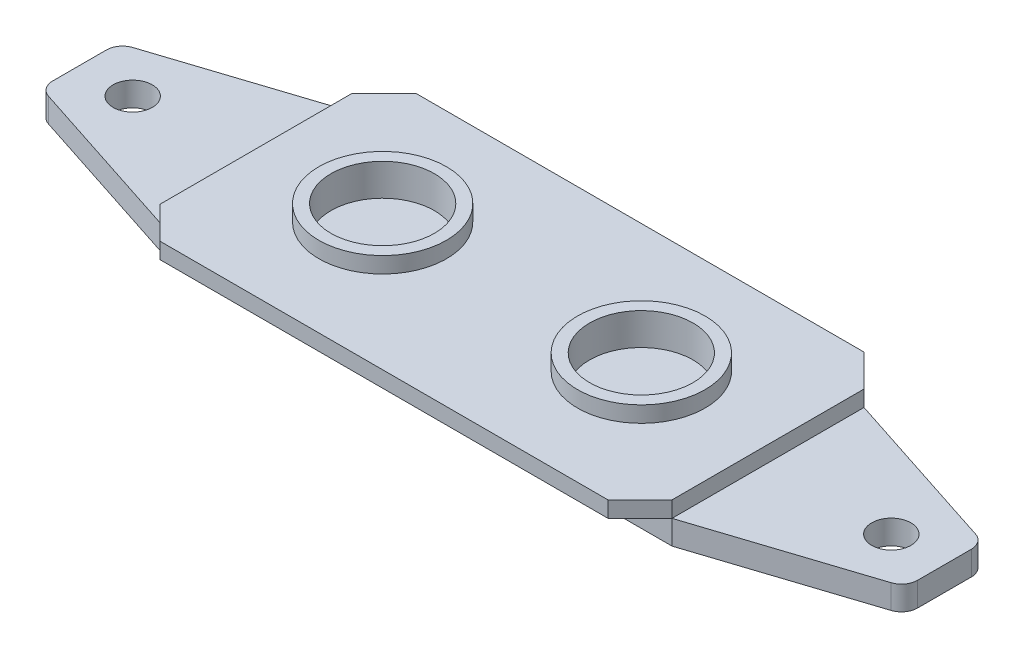
from build123d import *

# Parameters (mm, degrees)
EXTRUDE1_DEPTH = 3.175
SKETCH5_R      = 12.6587948
SKETCH5_R_2    = 10.263887676
EXTRUDE2_DEPTH = 3.175
SKETCH7_R      = 10.263887676
EXTRUDE3_DEPTH = 114.636616568
SKETCH8_R      = 3.888872997
SKETCH8_W      = 50.8
SKETCH8_H      = 38.1
EXTRUDE4_DEPTH = 4.7752


with BuildPart() as part:
    # Sketch4 → Extrude1 (new body)
    with BuildSketch(Plane(origin=(0, 0, 0), x_dir=(1, 0, 0), z_dir=(0, 1, 0))):
        Polygon((0, 44.45), (6.35, 50.8), (95.25, 50.8), (101.6, 44.45), (101.6, 6.35), (95.25, 0), (6.35, 0), (0, 6.35), align=None)
    extrude(amount=-EXTRUDE1_DEPTH)

    # Sketch5 → Extrude2 (add)
    # profile 1 of 2: a face of its own
    with BuildSketch(Plane(origin=(0, 0, 0), x_dir=(1, 0, 0), z_dir=(0, 1, 0))):
        with Locations(Location((25.140280811, 25.4, 0), (0, 0, 90))):
            Circle(SKETCH5_R)
        with Locations(Location((25.140280811, 25.4, 0), (0, 0, 270))):
            Circle(SKETCH5_R_2, mode=Mode.SUBTRACT)
    # profile 2 of 2: a face of its own
    with BuildSketch(Plane(origin=(0, 0, 0), x_dir=(1, 0, 0), z_dir=(0, 1, 0))):
        with Locations(Location((76.459719189, 25.4, 0), (0, 0, 90))):
            Circle(SKETCH5_R)
        with Locations(Location((76.459719189, 25.4, 0), (0, 0, 90))):
            Circle(SKETCH5_R_2, mode=Mode.SUBTRACT)
    extrude(amount=EXTRUDE2_DEPTH)

    # Sketch7 → Extrude3 (cut, through all)
    with BuildSketch(Plane(origin=(0, 0, 0), x_dir=(1, 0, 0), z_dir=(0, 1, 0))):
        with Locations(Location((25.140280811, 25.4, 0), (0, 0, 270))):
            Circle(SKETCH7_R)
        with Locations(Location((76.459719189, 25.4, 0), (0, 0, 90))):
            Circle(SKETCH7_R)
    extrude(amount=-EXTRUDE3_DEPTH, mode=Mode.SUBTRACT)

    # Sketch8 → Extrude4 (add)
    # profile 1 of 4: a face of its own
    with BuildSketch(Plane(origin=(0, -3.175, 0), x_dir=(-1, 0, 0), z_dir=(0, 1, 0))):
        with BuildLine():
            ThreePointArc((-134.414065233, -33.76600747), (-136.000297004, -32.612437385), (-136.606100968, -30.746999975))
            Line((-136.606100968, -30.746999975), (-136.606100968, -20.053000025))
            ThreePointArc((-136.606100968, -20.053000025), (-136.000297004, -18.187562615), (-134.414065233, -17.03399253))
            Line((-134.414065233, -17.03399253), (-101.6, -6.35))
            Line((-101.6, -6.35), (-101.6, -44.45))
            Line((-101.6, -44.45), (-134.414065233, -33.76600747))
        make_face()
        with Locations(Location((-126.068509621, -25.4, 0), (0, 0, 90))):
            Circle(SKETCH8_R, mode=Mode.SUBTRACT)
    # profile 2 of 4: a face of its own
    with BuildSketch(Plane(origin=(0, -3.175, 0), x_dir=(-1, 0, 0), z_dir=(0, 1, 0))):
        with Locations((-76.2, -25.4)):
            Rectangle(SKETCH8_W, SKETCH8_H)
    # profile 3 of 4: a face of its own
    with BuildSketch(Plane(origin=(0, -3.175, 0), x_dir=(-1, 0, 0), z_dir=(0, 1, 0))):
        with Locations((-25.4, -25.4)):
            Rectangle(SKETCH8_W, SKETCH8_H)
    # profile 4 of 4: a face of its own
    with BuildSketch(Plane(origin=(0, -3.175, 0), x_dir=(-1, 0, 0), z_dir=(0, 1, 0))):
        with BuildLine():
            ThreePointArc((32.814065233, -17.03399253), (34.400297004, -18.187562615), (35.006100968, -20.053000025))
            Line((35.006100968, -20.053000025), (35.006100968, -30.746999975))
            ThreePointArc((35.006100968, -30.746999975), (34.400297004, -32.612437385), (32.814065233, -33.76600747))
            Line((32.814065233, -33.76600747), (0, -44.45))
            Line((0, -44.45), (0, -6.35))
            Line((0, -6.35), (32.814065233, -17.03399253))
        make_face()
        with Locations(Location((24.468509621, -25.4, 0), (0, 0, 90))):
            Circle(SKETCH8_R, mode=Mode.SUBTRACT)
    extrude(amount=-EXTRUDE4_DEPTH)


solid = part.part
